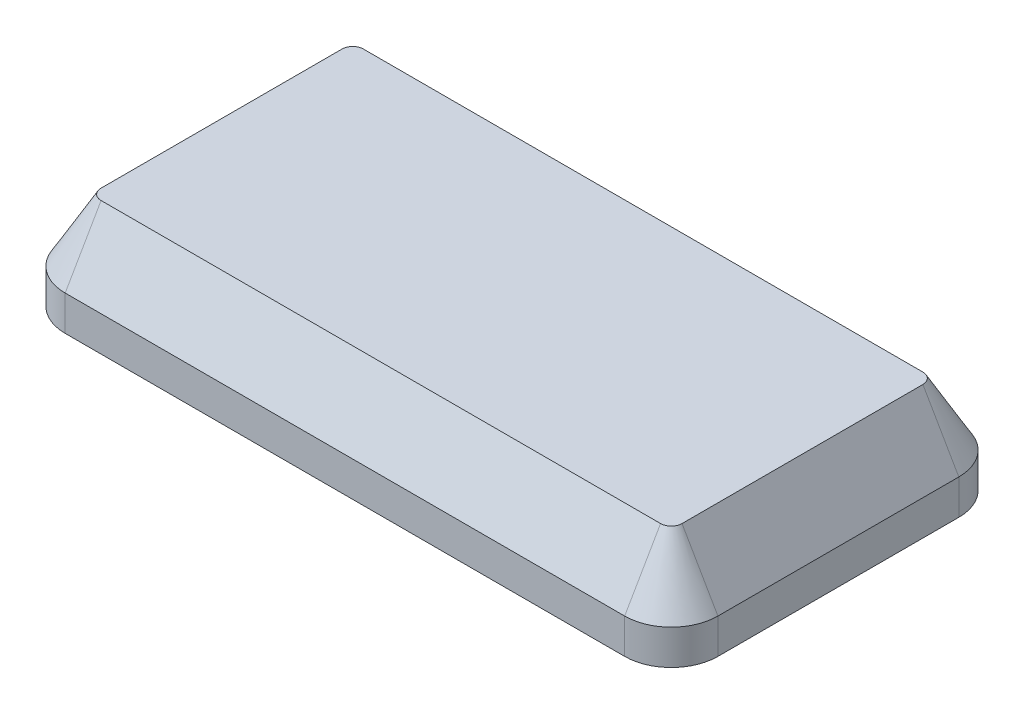
from build123d import *

# Parameters (mm, degrees)
EXTRUDE_1_DEPTH     = 4.5
CUT_EXTRUDE_1_DEPTH = 1
SKETCH_3_R          = 2.5
SKETCH_3_R_2        = 1.65
CUT_EXTRUDE_2_DEPTH = 3.4
EXTRUDE_2_DEPTH     = 8
EXTRUDE_2_TAPER     = 30


with BuildPart() as part:
    # 草图1 → 凸台-拉伸1 (new body)
    with BuildSketch(Plane(origin=(0, 0, 0), x_dir=(1, 0, 0), z_dir=(0, 1, 0))):
        with BuildLine():
            Line((-36, 21.5), (36, 21.5))
            ThreePointArc((36, 21.5), (40.242640687, 19.742640687), (42, 15.5))
            Line((42, 15.5), (42, -15.5))
            ThreePointArc((42, -15.5), (40.242640687, -19.742640687), (36, -21.5))
            Line((36, -21.5), (-36, -21.5))
            ThreePointArc((-36, -21.5), (-40.242640687, -19.742640687), (-42, -15.5))
            Line((-42, -15.5), (-42, 15.5))
            ThreePointArc((-42, 15.5), (-40.242640687, 19.742640687), (-36, 21.5))
        make_face()
    extrude(amount=EXTRUDE_1_DEPTH)

    # 草图2 → 切除-拉伸1 (cut)
    with BuildSketch(Plane.XZ):
        with BuildLine():
            Line((36, 20.5), (-36, 20.5))
            ThreePointArc((-36, 20.5), (-39.535533906, 19.035533906), (-41, 15.5))
            Line((-41, 15.5), (-41, -15.5))
            ThreePointArc((-41, -15.5), (-39.535533906, -19.035533906), (-36, -20.5))
            Line((-36, -20.5), (36, -20.5))
            ThreePointArc((36, -20.5), (39.535533906, -19.035533906), (41, -15.5))
            Line((41, -15.5), (41, 15.5))
            ThreePointArc((41, 15.5), (39.535533906, 19.035533906), (36, 20.5))
        make_face()
    extrude(amount=-CUT_EXTRUDE_1_DEPTH, mode=Mode.SUBTRACT)

    # 草图3 → 切除-拉伸2 (cut)
    # profile 1 of 5: a face of its own
    with BuildSketch(Plane(origin=(0, 1, 0), x_dir=(-1, 0, 0), z_dir=(0, -1, 0))):
        with BuildLine():
            Line((-41, 15.5), (-41, -15.5))
            ThreePointArc((-41, -15.5), (-39.535533906, -19.035533906), (-36, -20.5))
            Line((-36, -20.5), (36, -20.5))
            ThreePointArc((36, -20.5), (39.535533906, -19.035533906), (41, -15.5))
            Line((41, -15.5), (41, 15.5))
            ThreePointArc((41, 15.5), (39.535533906, 19.035533906), (36, 20.5))
            Line((36, 20.5), (-36, 20.5))
            ThreePointArc((-36, 20.5), (-39.535533906, 19.035533906), (-41, 15.5))
        make_face()
        with Locations(Location((36, 15.5, 0), (0, 0, 90))):
            Circle(SKETCH_3_R, mode=Mode.SUBTRACT)
        with Locations(Location((36, -15.5, 0), (0, 0, 90))):
            Circle(SKETCH_3_R, mode=Mode.SUBTRACT)
        with Locations(Location((-36, 15.5, 0), (0, 0, 90))):
            Circle(SKETCH_3_R, mode=Mode.SUBTRACT)
        with Locations(Location((-36, -15.5, 0), (0, 0, 90))):
            Circle(SKETCH_3_R, mode=Mode.SUBTRACT)
    # profile 2 of 5: a face of its own
    with BuildSketch(Plane(origin=(0, 1, 0), x_dir=(-1, 0, 0), z_dir=(0, -1, 0))):
        with Locations(Location((36, 15.5, 0), (0, 0, 90))):
            Circle(SKETCH_3_R_2)
    # profile 3 of 5: a face of its own
    with BuildSketch(Plane(origin=(0, 1, 0), x_dir=(-1, 0, 0), z_dir=(0, -1, 0))):
        with Locations(Location((36, -15.5, 0), (0, 0, 90))):
            Circle(SKETCH_3_R_2)
    # profile 4 of 5: a face of its own
    with BuildSketch(Plane(origin=(0, 1, 0), x_dir=(-1, 0, 0), z_dir=(0, -1, 0))):
        with Locations(Location((-36, -15.5, 0), (0, 0, 90))):
            Circle(SKETCH_3_R_2)
    # profile 5 of 5: a face of its own
    with BuildSketch(Plane(origin=(0, 1, 0), x_dir=(-1, 0, 0), z_dir=(0, -1, 0))):
        with Locations(Location((-36, 15.5, 0), (0, 0, 90))):
            Circle(SKETCH_3_R_2)
    extrude(amount=-CUT_EXTRUDE_2_DEPTH, mode=Mode.SUBTRACT)

    # 草图5 → 凸台-拉伸2 (add)
    with BuildSketch(Plane(origin=(0, 4.5, 0), x_dir=(1, 0, 0), z_dir=(0, 1, 0))):
        with BuildLine():
            Line((42, -15.5), (42, 15.5))
            ThreePointArc((42, 15.5), (40.242640687, 19.742640687), (36, 21.5))
            Line((36, 21.5), (-36, 21.5))
            ThreePointArc((-36, 21.5), (-40.242640687, 19.742640687), (-42, 15.5))
            Line((-42, 15.5), (-42, -15.5))
            ThreePointArc((-42, -15.5), (-40.242640687, -19.742640687), (-36, -21.5))
            Line((-36, -21.5), (36, -21.5))
            ThreePointArc((36, -21.5), (40.242640687, -19.742640687), (42, -15.5))
        make_face()
    extrude(amount=EXTRUDE_2_DEPTH, taper=EXTRUDE_2_TAPER)


solid = part.part
